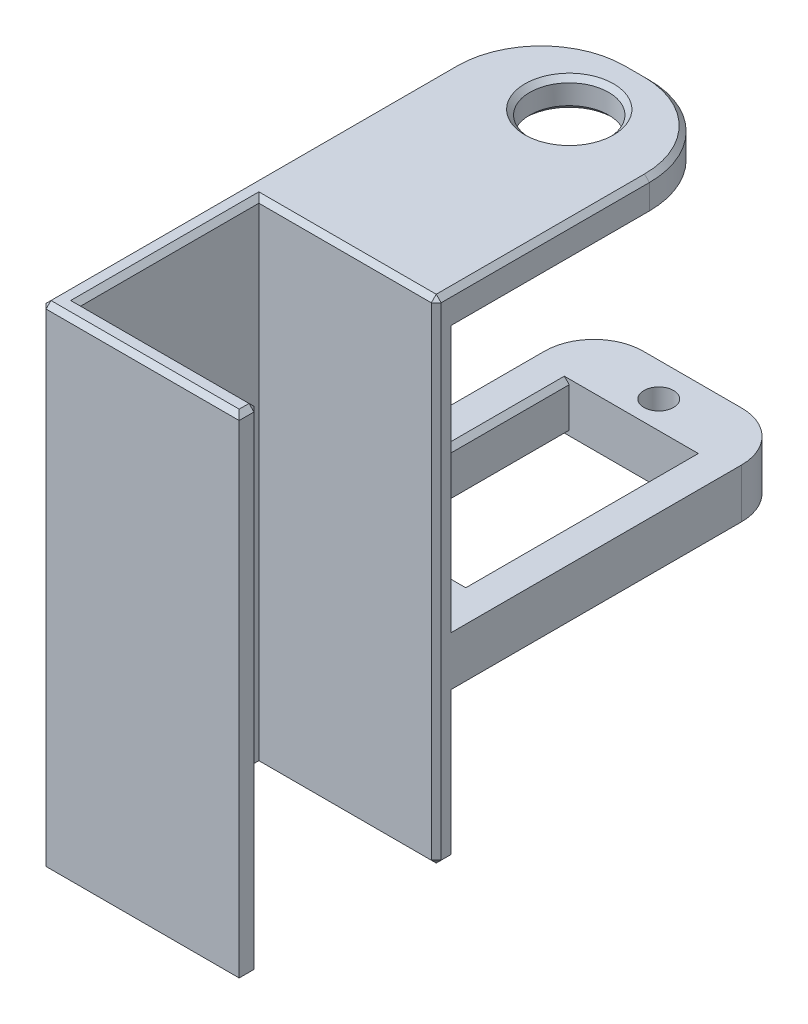
from build123d import *

# Parameters (mm, degrees)
SKETCH1_W           = 20
SKETCH1_H           = 50
BOSS_EXTRUDE1_DEPTH = 2
BOSS_EXTRUDE2_DEPTH = 50
SKETCH3_R           = 4
BOSS_EXTRUDE3_DEPTH = 3
SKETCH4_W           = 12.6
SKETCH4_H           = 23.6
BOSS_EXTRUDE4_DEPTH = 5
CHAMFER1_SIZE       = 0.5
CHAMFER2_SIZE       = 0.5
SKETCH5_R           = 1.5
CUT_EXTRUDE1_DEPTH  = 5


with BuildPart() as part:
    # Sketch1 → Boss-Extrude1 (new body)
    with BuildSketch(Plane.XY):
        with Locations((0, 25)):
            Rectangle(SKETCH1_W, SKETCH1_H)
    extrude(amount=BOSS_EXTRUDE1_DEPTH)

    # Sketch2 → Boss-Extrude2 (add)
    with BuildSketch(Plane.XZ):
        Polygon((-10, 2), (-10, 22.1), (10.1, 22.1), (10.1, 20.1), (-8, 20.1), (-8, 2), align=None)
    extrude(amount=-BOSS_EXTRUDE2_DEPTH)

    # Sketch3 → Boss-Extrude3 (add)
    with BuildSketch(Plane(origin=(0, 50, 0), x_dir=(1, 0, 0), z_dir=(0, 1, 0))):
        with BuildLine():
            Line((1, 28.638755942), (-1, 28.638755942))
            ThreePointArc((-1, 28.638755942), (-7.363961031, 26.002716972), (-10, 19.638755942))
            Line((-10, 19.638755942), (-10, 0))
            Line((-10, 0), (10, 0))
            Line((10, 0), (10, 19.638755942))
            ThreePointArc((10, 19.638755942), (7.363961031, 26.002716972), (1, 28.638755942))
        make_face()
        with Locations(Location((0, 21.5, 0), (0, 0, 270))):
            Circle(SKETCH3_R, mode=Mode.SUBTRACT)
    extrude(amount=-BOSS_EXTRUDE3_DEPTH)

    # Sketch4 → Boss-Extrude4 (add)
    with BuildSketch(Plane(origin=(0, 20, 0), x_dir=(-1, 0, 0), z_dir=(0, -1, 0))):
        with BuildLine():
            Line((-10, 0), (10, 0))
            Line((10, 0), (10, 29))
            ThreePointArc((10, 29), (8.535533906, 32.535533906), (5, 34))
            Line((5, 34), (-5, 34))
            ThreePointArc((-5, 34), (-8.535533906, 32.535533906), (-10, 29))
            Line((-10, 29), (-10, 0))
        make_face()
        with Locations((0, 16)):
            Rectangle(SKETCH4_W, SKETCH4_H, mode=Mode.SUBTRACT)
    extrude(amount=BOSS_EXTRUDE4_DEPTH)

    # Chamfer1
    chamfer1_edges = [part.edges().sort_by_distance(p)[0] for p in [
        (1, 0, 2),
        (-10, 25, 22.1),
        (10.1, 25, 20.1),
        (-8, 0, 11.05),
        (1.05, 0, 20.1),
        (10.1, 0, 21.1),
        (0.05, 0, 22.1),
        (0.05, 50, 22.1),
        (10.1, 50, 21.1),
        (1.05, 50, 20.1),
        (-8, 50, 11.05),
        (-10, 33.5, 0),
        (0, 50, -25.5),
        (0, 50, -28.638755942),
        (-7.363961031, 50, -26.002716972),
        (7.363961031, 50, -26.002716972),
        (10, 25, 2),
        (0, 0, 0),
        (-10, 7.5, 0),
        (10, 33.5, 0),
        (6.3, 20, -16),
        (-6.3, 20, -16),
        (6.3, 15, -16),
        (10, 7.5, 0),
        (-6.3, 15, -16),
        (1, 50, 2),
        (10, 0, 1),
        (-10, 0, 11.05),
        (-10, 50, 1.230622029),
        (10, 50, -8.819377971),
    ]]
    chamfer(chamfer1_edges, length=CHAMFER1_SIZE)

    # Chamfer2
    chamfer2_edges = [part.edges().sort_by_distance(p)[0] for p in [
        (0, 47, -25.5),
    ]]
    chamfer(chamfer2_edges, length=CHAMFER2_SIZE)

    # Sketch5 → Cut-Extrude1 (cut)
    with BuildSketch(Plane(origin=(0, 20, 0), x_dir=(1, 0, 0), z_dir=(0, 1, 0))):
        with Locations(Location((0, 30.585786438, 0), (0, 0, 180))):
            Circle(SKETCH5_R)
        with Locations(Location((0, 1.414213562, 0), (0, 0, 250.528779366))):
            Circle(SKETCH5_R)
    extrude(amount=-CUT_EXTRUDE1_DEPTH, mode=Mode.SUBTRACT)


solid = part.part
